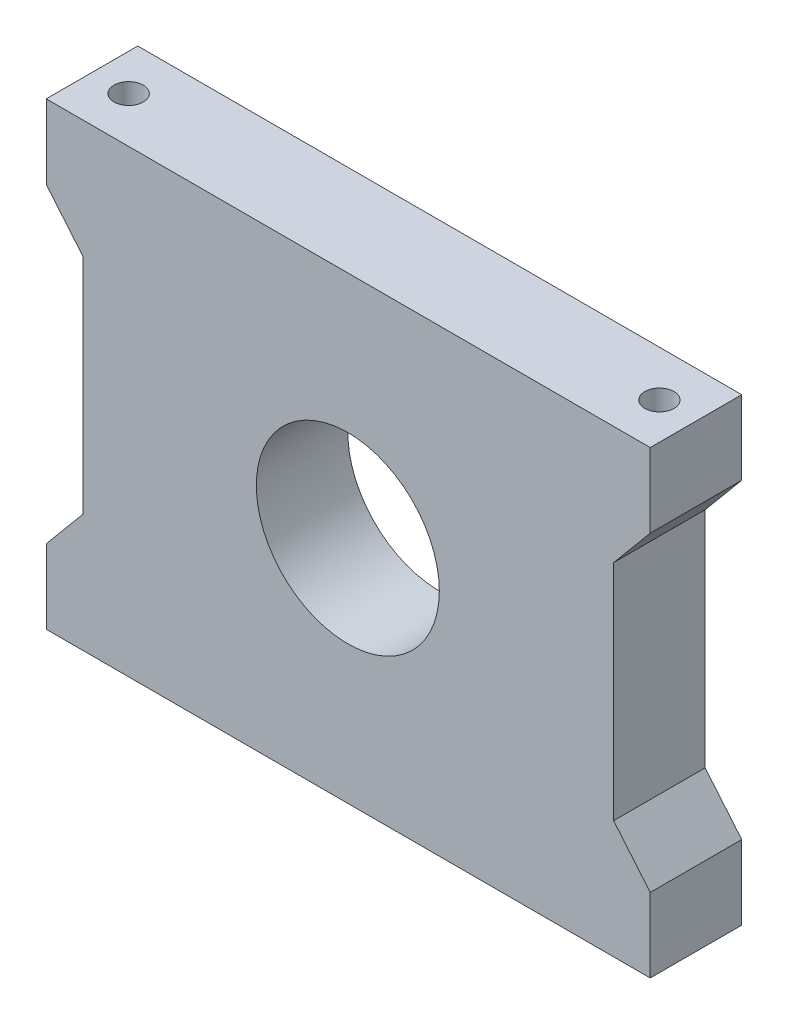
from build123d import *

# Parameters (mm, degrees)
SZKIC1_R                    = 10
DODANIE_WYCI_GNI_CIE1_DEPTH = 10
SZKIC2_R                    = 1.6
WYTNIJ_WYCI_GNI_CIE1_DEPTH  = 10


with BuildPart() as part:
    # Szkic1 → Dodanie-wyciągnięcie1 (new body)
    with BuildSketch(Plane.XY):
        Polygon((0, 0), (66, 0), (66, 8.1), (62, 12.886908539), (62, 37.313091461), (66, 42.1), (66, 50.2), (0, 50.2), (0, 42.1), (4, 37.313091461), (4, 12.886908539), (0, 8.1), align=None)
        with Locations((32.952408039, 25.1)):
            Circle(SZKIC1_R, mode=Mode.SUBTRACT)
    extrude(amount=DODANIE_WYCI_GNI_CIE1_DEPTH)

    # Szkic2 → Wytnij-wyciągnięcie1 (cut)
    with BuildSketch(Plane(origin=(0, 50.2, 0), x_dir=(1, 0, 0), z_dir=(0, 1, 0))):
        with Locations(Location((4, -5, 0), (0, 0, 270))):
            Circle(SZKIC2_R)
        with Locations(Location((62, -5, 0), (0, 0, 90))):
            Circle(SZKIC2_R)
    wytnij_wyci_gni_cie1 = extrude(amount=-WYTNIJ_WYCI_GNI_CIE1_DEPTH, mode=Mode.SUBTRACT)

    # Lustro1: Wytnij-wyciągnięcie1 across plane
    add(wytnij_wyci_gni_cie1.mirror(Plane.ZX.offset(25.1)), mode=Mode.SUBTRACT)


solid = part.part
